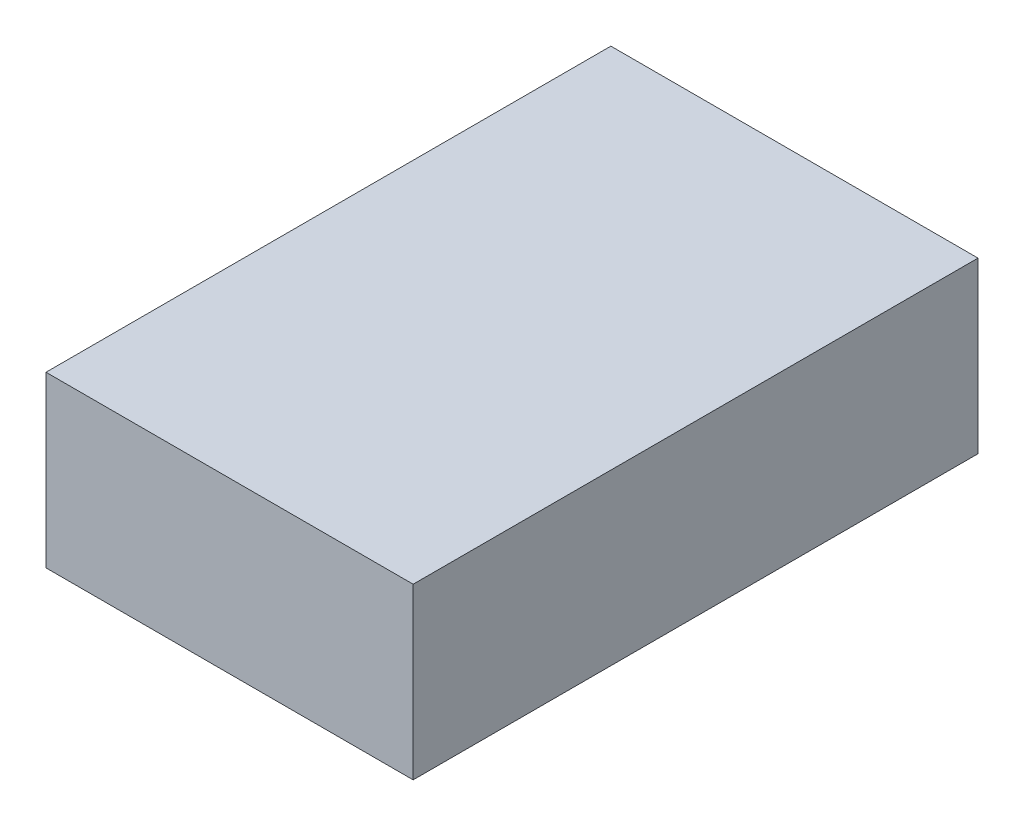
from build123d import *

# Parameters (mm, degrees)
SKETCH2_W           = 165.1
SKETCH2_H           = 254
BOSS_EXTRUDE1_DEPTH = 76.2


with BuildPart() as part:
    # Sketch2 → Boss-Extrude1 (new body)
    with BuildSketch(Plane(origin=(0, 0, 0), x_dir=(1, 0, 0), z_dir=(0, 1, 0))):
        with Locations((82.55, 127)):
            Rectangle(SKETCH2_W, SKETCH2_H)
    extrude(amount=BOSS_EXTRUDE1_DEPTH)


solid = part.part
